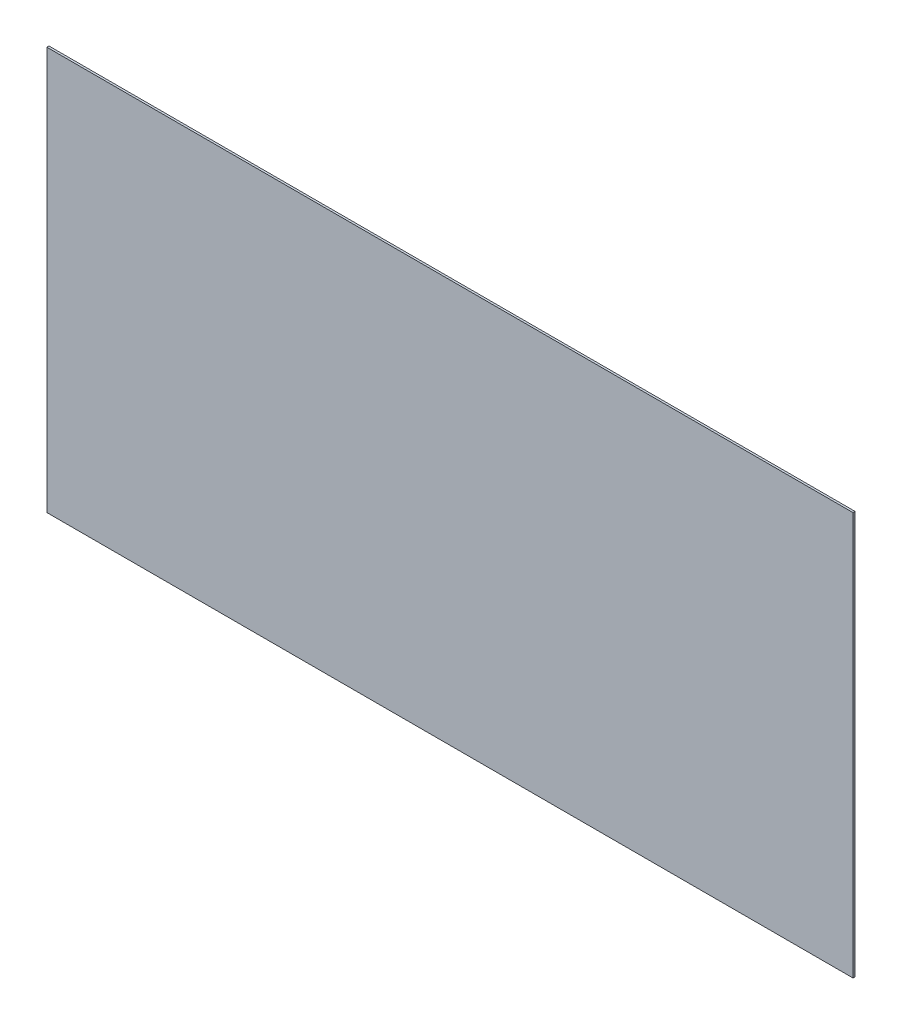
from build123d import *

# Parameters (mm, degrees)
SKETCH1_W           = 1219.2
SKETCH1_H           = 609.6
BOSS_EXTRUDE1_DEPTH = 3.175


with BuildPart() as part:
    # Sketch1 → Boss-Extrude1 (new body)
    with BuildSketch(Plane.XY):
        Rectangle(SKETCH1_W, SKETCH1_H)
    extrude(amount=BOSS_EXTRUDE1_DEPTH)


solid = part.part
